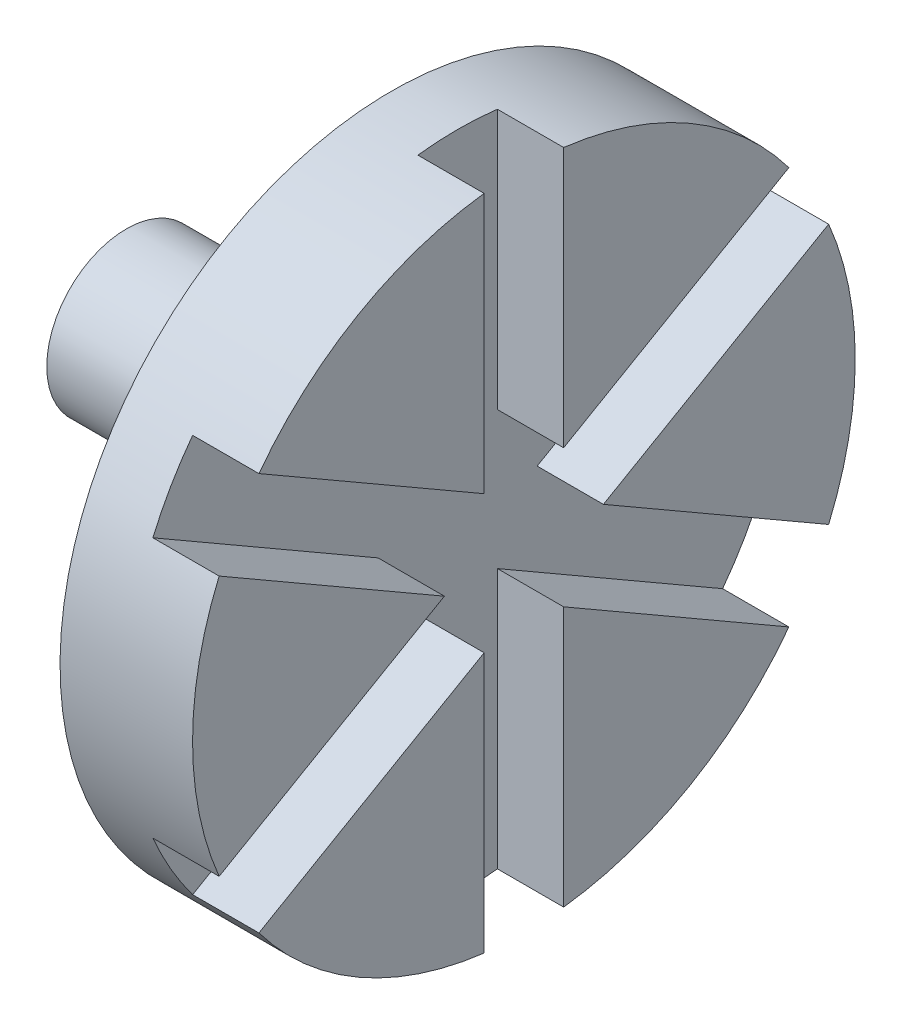
from build123d import *

# Parameters (mm, degrees)
SKETCH1_R           = 50
BOSS_EXTRUDE1_DEPTH = 10
BOSS_EXTRUDE2_DEPTH = 10
SKETCH9_R           = 12
BOSS_EXTRUDE3_DEPTH = 40


with BuildPart() as part:
    # Sketch1 → Boss-Extrude1 (new body)
    with BuildSketch(Plane(origin=(0, 0, 0), x_dir=(0, 0, -1), z_dir=(1, 0, 0))):
        Circle(SKETCH1_R)
    extrude(amount=BOSS_EXTRUDE1_DEPTH)

    # Sketch7 → Boss-Extrude2 (add)
    with BuildSketch(Plane(origin=(10, 0, 0), x_dir=(0, 0, -1), z_dir=(1, 0, 0))):
        with BuildLine():
            Line((12, 0), (45.98837052, -19.623194869))
            ThreePointArc((45.98837052, -19.623194869), (50, 0), (45.98837052, 19.623194869))
            Line((45.98837052, 19.623194869), (12, 0))
        make_face()
        with BuildLine():
            Line((6, -10.392304845), (6, -49.638694584))
            ThreePointArc((6, -49.638694584), (25, -43.301270189), (39.98837052, -30.015499715))
            Line((39.98837052, -30.015499715), (6, -10.392304845))
        make_face()
        with BuildLine():
            Line((6, 10.392304845), (39.98837052, 30.015499715))
            ThreePointArc((39.98837052, 30.015499715), (25, 43.301270189), (6, 49.638694584))
            Line((6, 49.638694584), (6, 10.392304845))
        make_face()
        with BuildLine():
            Line((-6, -10.392304845), (-39.98837052, -30.015499715))
            ThreePointArc((-39.98837052, -30.015499715), (-25, -43.301270189), (-6, -49.638694584))
            Line((-6, -49.638694584), (-6, -10.392304845))
        make_face()
        with BuildLine():
            Line((-12, 0), (-45.98837052, 19.623194869))
            ThreePointArc((-45.98837052, 19.623194869), (-50, 0), (-45.98837052, -19.623194869))
            Line((-45.98837052, -19.623194869), (-12, 0))
        make_face()
        with BuildLine():
            Line((-6, 10.392304845), (-6, 49.638694584))
            ThreePointArc((-6, 49.638694584), (-25, 43.301270189), (-39.98837052, 30.015499715))
            Line((-39.98837052, 30.015499715), (-6, 10.392304845))
        make_face()
    extrude(amount=BOSS_EXTRUDE2_DEPTH)

    # Sketch9 → Boss-Extrude3 (add)
    with BuildSketch(Plane.ZY):
        Circle(SKETCH9_R)
    extrude(amount=BOSS_EXTRUDE3_DEPTH)


solid = part.part
